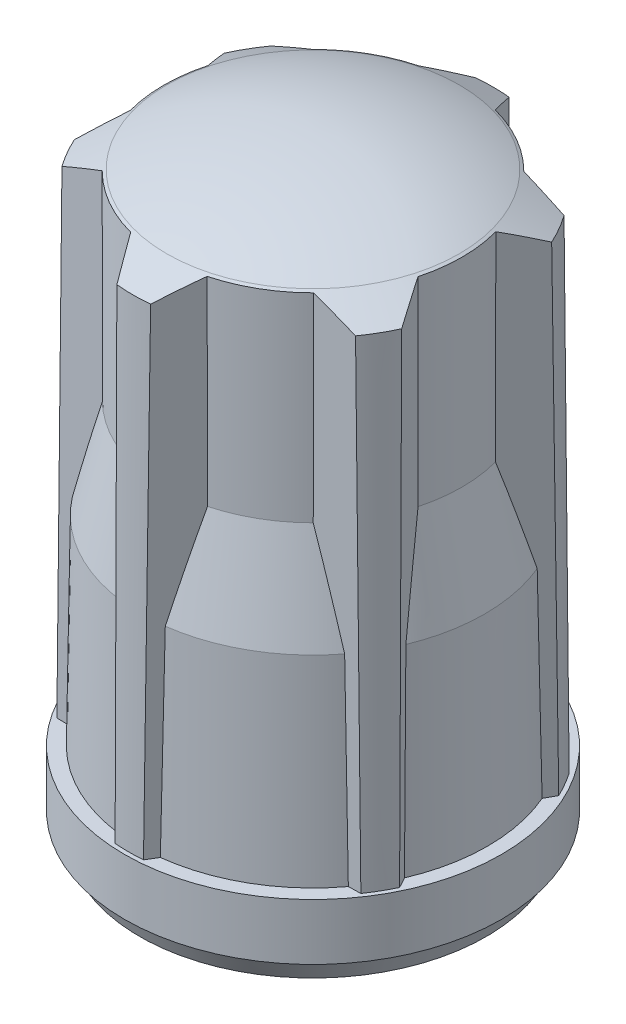
from build123d import *

# Parameters (mm, degrees)
EXTRUS_O1_REACH       = 12.571
CIRPATTERN1_COUNT     = 6
FILETE1_R             = 0.3
ESBO_O24_R            = 3.35
CORTE_EXTRUS_O1_DEPTH = 0.3


with BuildPart() as part:
    # Esboço1 → Revolução1 (revolve)
    with BuildSketch(Plane.XY, mode=Mode.PRIVATE) as revolu_o1_sk:
        Polygon((0, 0), (-3.35, 0), (-3.35, 1.3), (-3.1, 1.3), (-3.05, 4.85), (-2.645980666, 6.6), (-2.65, 10.75), (0, 10.75), align=None)
    revolve(revolu_o1_sk.sketch.rotate(Axis((0, 0, 0), (0, 1, 0)), 270), axis=Axis((0, 0, 0), (0, 1, 0)))

    # Extrusão1: up to this face of the body (flat: up to its plane)
    extrus_o1_end = Plane(part.part.faces().sort_by_distance((0, 10.75, 0))[0])
    # Esboço2 → Extrusão1 (add, up to the picked face)
    with BuildSketch(Plane.XZ.offset(-1.3), mode=Mode.PRIVATE) as extrus_o1_sk1:
        with BuildLine():
            Line((-0.837606703, -2.3), (-0.204201147, -3.34377061))
            ThreePointArc((-0.204201147, -3.34377061), (0, -3.35), (0.204201147, -3.34377061))
            Line((0.204201147, -3.34377061), (0.837606703, -2.3))
            Line((0.837606703, -2.3), (-0.837606703, -2.3))
        make_face()
    extrus_o1_tool1 = split(extrude(extrus_o1_sk1.sketch, amount=-EXTRUS_O1_REACH, mode=Mode.PRIVATE), bisect_by=extrus_o1_end, keep=Keep.BOTH, mode=Mode.PRIVATE)
    add(extrus_o1_tool1.solids().sort_by(Axis((0, 1.3, -2.7171), (0, 1, 0)))[0])

    # CirPattern1: part ×6 about axis
    cirpattern1_axis = Axis((0, 0, 0), (0, 1, 0))


with BuildPart() as part_1:
    add(part.part)
    for i in range(1, CIRPATTERN1_COUNT):
        add(part.part.rotate(cirpattern1_axis, i * 360 / CIRPATTERN1_COUNT))

    # Esboço3 → Corte-Revolução5 (revolve, cut)
    with BuildSketch(Plane.XY):
        with BuildLine():
            Line((-3.2, 9.837667271), (-2.6, 10.170252702))
            ThreePointArc((-2.6, 10.170252702), (-1.331925949, 10.603305054), (0, 10.75))
            Line((0, 10.75), (0, 11.25))
            Line((0, 11.25), (-4, 11.25))
            Line((-4, 11.25), (-4, 1.3))
            Line((-4, 1.3), (-3.274507094, 1.3))
            Line((-3.274507094, 1.3), (-3.2, 9.837667271))
        make_face()
    revolve(axis=Axis((0, 0, 0), (0, 1, 0)), mode=Mode.SUBTRACT)

    # Filete1
    filete1_edges = [part_1.edges().sort_by_distance(p)[0] for p in [
        (0, 0, 3.35),
    ]]
    fillet(filete1_edges, radius=FILETE1_R)

    # Esboço24 → Corte-extrusão1 (cut)
    with BuildSketch(Plane.XZ):
        with Locations(Location((0, 0, 0), (0, 0, 270))):
            Circle(ESBO_O24_R)
    extrude(amount=-CORTE_EXTRUS_O1_DEPTH, mode=Mode.SUBTRACT)

    # Esboço22 → Revolução3 (revolve)
    with BuildSketch(Plane.XY, mode=Mode.PRIVATE) as revolu_o3_sk:
        Polygon((-0.5, 0.3), (-0.5, -0.1), (-3.079906965, -0.1), (-3.275, 0.3), align=None)
    revolve(revolu_o3_sk.sketch.rotate(Axis((0, 0, 0), (0, 1, 0)), 270), axis=Axis((0, 0, 0), (0, 1, 0)))

    # Esboço8 → Corte-Revolução6 (revolve, cut)
    with BuildSketch(Plane.XY, mode=Mode.PRIVATE) as corte_revolu_o6_sk:
        with BuildLine():
            Line((-2.808342723, -0.1), (0, -0.1))
            Line((0, -0.1), (0, 9.45))
            ThreePointArc((0, 9.45), (-1.041301106, 9.347940177), (-2.05, 9.07))
            Line((-2.05, 9.07), (-2.05, 8.47))
            ThreePointArc((-2.05, 8.47), (-1.9, 8.17), (-2.05, 7.87))
            Line((-2.05, 7.87), (-2.05, 7.37))
            Line((-2.05, 7.37), (-2.45, 5.63740965))
            Line((-2.45, 5.63740965), (-2.45, 0.45))
            ThreePointArc((-2.45, 0.45), (-2.508578644, 0.308578644), (-2.65, 0.25))
            Line((-2.65, 0.25), (-2.79, 0.25))
            Line((-2.79, 0.25), (-2.808342723, -0.1))
        make_face()
    revolve(corte_revolu_o6_sk.sketch.rotate(Axis((0, -0.1, 0), (0, 1, 0)), 270), axis=Axis((0, -0.1, 0), (0, 1, 0)), mode=Mode.SUBTRACT)


solid = part_1.part
